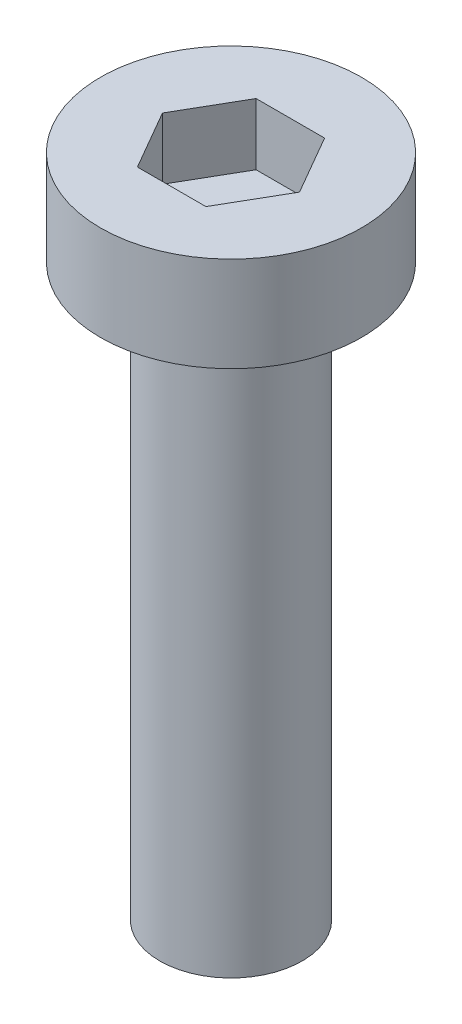
from build123d import *

# Parameters (mm, degrees)
SKETCH_1_R          = 2.75
EXTRUDE_397_DEPTH   = 2
SKETCH_1_3_R        = 1.5
EXTRUDE_432_DEPTH   = 12
CUT_EXTRUDE_1_DEPTH = 1.3


with BuildPart() as part:
    # 草图1 → Extrude 397 (new body)
    with BuildSketch(Plane(origin=(0, 0, 0), x_dir=(1, 0, 0), z_dir=(0, 1, 0))):
        Circle(SKETCH_1_R)
    extrude(amount=EXTRUDE_397_DEPTH)

    # 草图1<3> → Extrude 432 (add)
    with BuildSketch(Plane(origin=(0, 0, 0), x_dir=(1, 0, 0), z_dir=(0, 1, 0))):
        Circle(SKETCH_1_3_R)
    extrude(amount=-EXTRUDE_432_DEPTH)

    # 草图2 → 切除-拉伸1 (cut)
    with BuildSketch(Plane(origin=(0, 2, 0), x_dir=(1, 0, 0), z_dir=(0, 1, 0))):
        Polygon((1.443375673, 0), (0.721687836, 1.25), (-0.721687836, 1.25), (-1.443375673, 0), (-0.721687836, -1.25), (0.721687836, -1.25), align=None)
    extrude(amount=-CUT_EXTRUDE_1_DEPTH, mode=Mode.SUBTRACT)


solid = part.part
